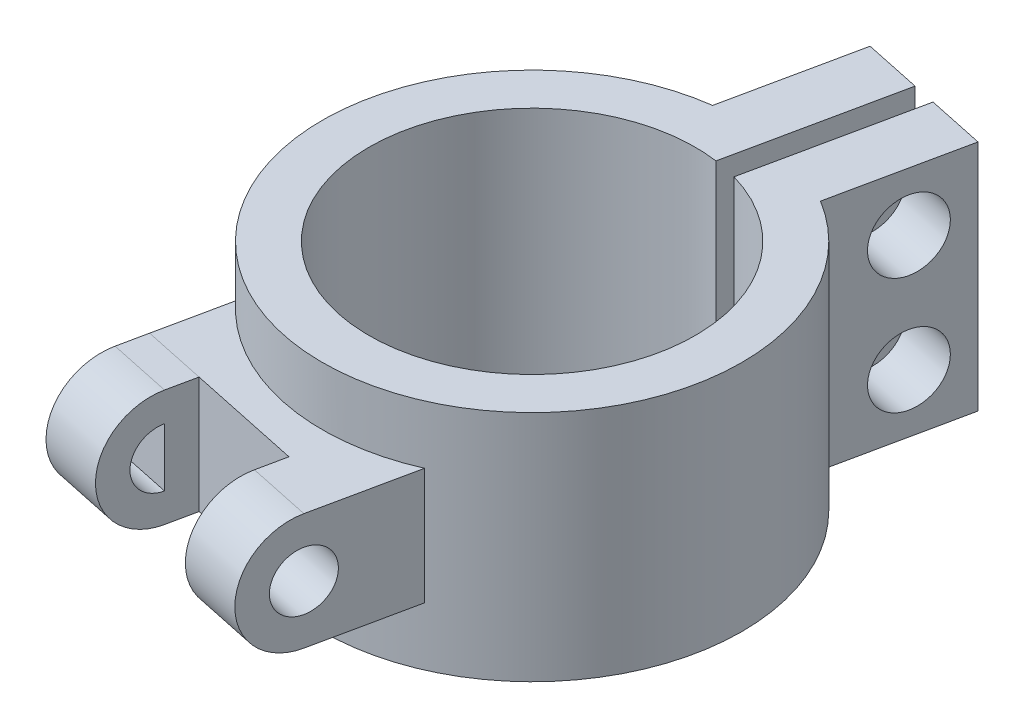
from build123d import *

# Parameters (mm, degrees)
BOSS_EXTRUDE1_DEPTH = 40
SKETCH2_R           = 6
CUT_EXTRUDE1_DEPTH  = 40
BOSS_EXTRUDE2_DEPTH = 10
SKETCH5_W           = 42
SKETCH5_H           = 20
BOSS_EXTRUDE3_DEPTH = 19
CUT_EXTRUDE3_DEPTH  = 100.644488095
BOSS_EXTRUDE6_DEPTH = 11
CUT_EXTRUDE4_DEPTH  = 101.019808074
BOSS_EXTRUDE7_DEPTH = 11
CUT_EXTRUDE8_START  = -11
CUT_EXTRUDE8_DEPTH  = 11


with BuildPart() as part:
    # Sketch1 → Boss-Extrude1 (new body)
    with BuildSketch(Plane(origin=(0, 0, 0), x_dir=(1, 0, 0), z_dir=(0, 1, 0))):
        with BuildLine():
            Line((30.661481596, 40.410991), (35.379533666, 62.721496963))
            Line((35.379533666, 62.721496963), (45.163161914, 60.652531445))
            Line((45.163161914, 60.652531445), (39.201114242, 32.459476736))
            ThreePointArc((39.201114242, 32.459476736), (29.586430218, -22.672662131), (43.114565541, 31.631890529))
            Line((43.114565541, 31.631890529), (49.076613213, 59.824945239))
            Line((49.076613213, 59.824945239), (58.860241461, 57.755979721))
            Line((58.860241461, 57.755979721), (54.14218939, 35.445473759))
            ThreePointArc((54.14218939, 35.445473759), (27.931257804, -30.499564729), (30.661481596, 40.410991))
        make_face()
    extrude(amount=BOSS_EXTRUDE1_DEPTH)

    # Sketch2 → Cut-Extrude1 (cut)
    with BuildSketch(Plane(origin=(44.649699848, 0, 9.442170839), x_dir=(0.20689655172413562, 0, -0.9783628247662838), z_dir=(0.9783628247662838, 0, 0.20689655172413562))):
        with Locations((58.684284459, 30)):
            Circle(SKETCH2_R)
        with Locations((58.684284459, 10)):
            Circle(SKETCH2_R)
    extrude(amount=-CUT_EXTRUDE1_DEPTH, mode=Mode.SUBTRACT)



with BuildPart() as body_2:
    # Sketch3 → Boss-Extrude2 (new, symmetric)
    with BuildSketch(Plane(origin=(0, 20, 0), x_dir=(1, 0, 0), z_dir=(0, 1, 0))):
        Polygon((16.190903907, -28.016806108), (7.385638484, -26.154737143), (5.168950645, -36.636907859), (46.260189285, -45.326563031), (48.476877124, -34.844392315), (39.671611701, -32.98232335), align=None)
    extrude(amount=BOSS_EXTRUDE2_DEPTH, both=True)


with BuildPart() as part_1:
    add(part.part)

    add(body_2.part)  # Boss-Extrude3 merges body 2
    # Sketch5 → Boss-Extrude3 (add)
    with BuildSketch(Plane(origin=(-7.194775986, 0, 34.022323226), x_dir=(0.9783628247662839, 0, 0.2068965517241352), z_dir=(-0.2068965517241352, 0, 0.9783628247662839))):
        with Locations((33.637159056, 20)):
            Rectangle(SKETCH5_W, SKETCH5_H)
    extrude(amount=-BOSS_EXTRUDE3_DEPTH)

    # Sketch7 → Cut-Extrude3 (cut, through all)
    with BuildSketch(Plane(origin=(0, 30, 0), x_dir=(1, 0, 0), z_dir=(0, 1, 0))):
        Polygon((47.294672044, -40.434748907), (6.203433404, -31.745093735), (5.168950645, -36.636907859), (46.260189285, -45.326563031), align=None)
    extrude(amount=-CUT_EXTRUDE3_DEPTH, mode=Mode.SUBTRACT)

    # Sketch9 → Boss-Extrude6 (add)
    with BuildSketch(Plane(origin=(53.454965271, 0, 11.304239805), x_dir=(0.20689655172413524, 0, -0.9783628247662839), z_dir=(0.9783628247662839, 0, 0.20689655172413524))):
        with BuildLine():
            Line((-29.774750599, 30), (-34.774750599, 30))
            ThreePointArc((-34.774750599, 30), (-44.774750599, 20), (-34.774750599, 10))
            Line((-34.774750599, 10), (-29.774750599, 10))
            Line((-29.774750599, 10), (-29.774750599, 30))
        make_face()
        with BuildLine():
            Line((-34.774750599, 25), (-34.774750599, 15))
            ThreePointArc((-34.774750599, 15), (-39.774750599, 20), (-34.774750599, 25))
        make_face(mode=Mode.SUBTRACT)
    extrude(amount=-BOSS_EXTRUDE6_DEPTH)

    # Sketch10 → Cut-Extrude4 (cut, through all)
    with BuildSketch(Plane(origin=(53.454965271, 0, 11.304239805), x_dir=(0.20689655172413524, 0, -0.9783628247662839), z_dir=(0.9783628247662839, 0, 0.20689655172413524))):
        with BuildLine():
            Line((-34.774750599, 15), (-34.774750599, 25))
            ThreePointArc((-34.774750599, 25), (-29.774750599, 20), (-34.774750599, 15))
        make_face()
    extrude(amount=-CUT_EXTRUDE4_DEPTH, mode=Mode.SUBTRACT)


with BuildPart() as body_2_2:
    # Sketch11 → Boss-Extrude7 (new body)
    with BuildSketch(Plane(origin=(12.363726631, 0, 2.614584632), x_dir=(-0.20689655172413524, 0, 0.9783628247662839), z_dir=(-0.9783628247662839, 0, -0.20689655172413524))):
        with BuildLine():
            Line((34.774750599, 30), (29.774750599, 30))
            Line((29.774750599, 30), (29.774750599, 10))
            Line((29.774750599, 10), (34.774750599, 10))
            ThreePointArc((34.774750599, 10), (44.774750599, 20), (34.774750599, 30))
        make_face()
    extrude(amount=-BOSS_EXTRUDE7_DEPTH)

    # Sketch12 → Cut-Extrude8 (cut)
    with BuildSketch(Plane(origin=(12.363726631, 0, 2.614584632), x_dir=(-0.20689655172413526, 0, 0.9783628247662839), z_dir=(-0.9783628247662839, 0, -0.20689655172413526)).offset(CUT_EXTRUDE8_START)):
        with BuildLine():
            ThreePointArc((39.774750599, 20), (38.310284505, 23.535533906), (34.774750599, 25))
            Line((34.774750599, 25), (34.774750599, 15))
            ThreePointArc((34.774750599, 15), (38.310284505, 16.464466094), (39.774750599, 20))
        make_face()
    extrude(amount=CUT_EXTRUDE8_DEPTH, mode=Mode.SUBTRACT)


solid = Compound([part_1.part, body_2_2.part])
